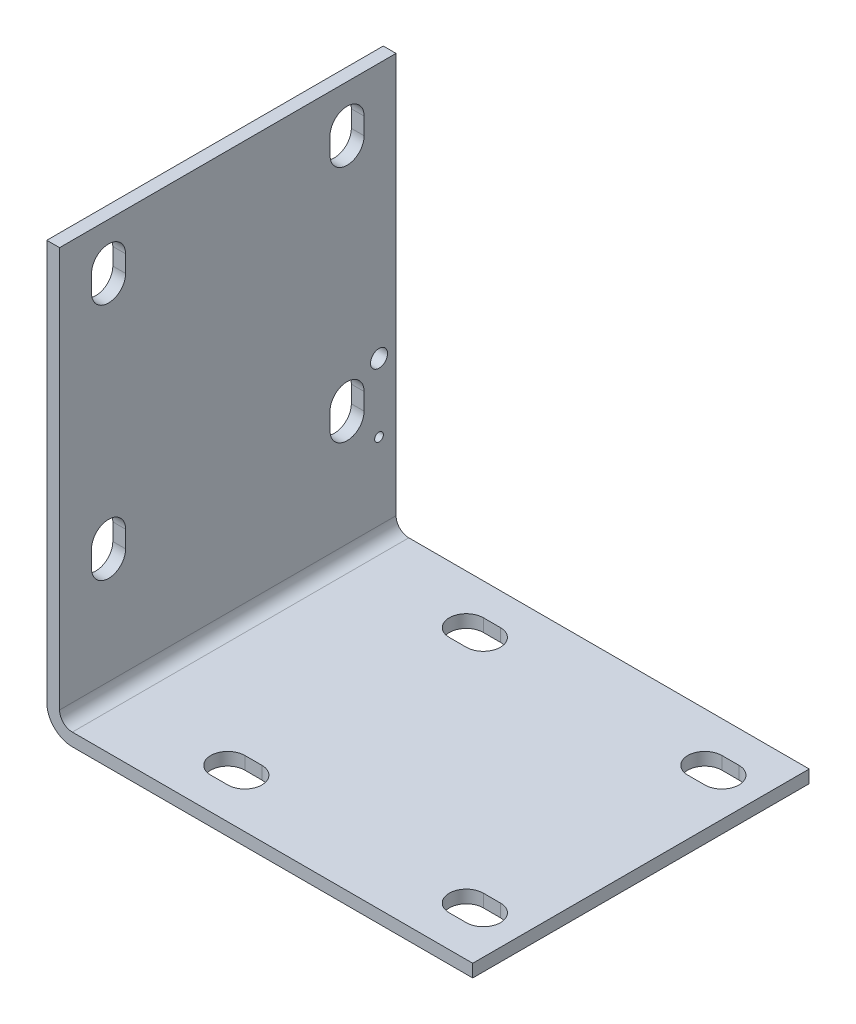
from build123d import *

# Parameters (mm, degrees)
BOSS_EXTRUDE1_DEPTH = 62.70625
CUT_EXTRUDE1_DEPTH  = 224.410663511
SKETCH3_R           = 1.625
SKETCH3_R_2         = 3.175
CUT_EXTRUDE2_DEPTH  = 224.410663511


with BuildPart() as part:
    # Sketch1 → Boss-Extrude1 (new, symmetric)
    with BuildSketch(Plane.XY):
        with BuildLine():
            Line((-9.525, 149.225), (-4.7625, 149.225))
            Line((-4.7625, 149.225), (-4.7625, 0))
            ThreePointArc((-4.7625, 0), (-3.367596045, -3.367596045), (0, -4.7625))
            Line((0, -4.7625), (149.225, -4.7625))
            Line((149.225, -4.7625), (149.225, -9.525))
            Line((149.225, -9.525), (0, -9.525))
            ThreePointArc((0, -9.525), (-6.735192091, -6.735192091), (-9.525, 0))
            Line((-9.525, 0), (-9.525, 149.225))
        make_face()
    extrude(amount=BOSS_EXTRUDE1_DEPTH, both=True)

    # Sketch2 → Cut-Extrude1 (cut, through all)
    with BuildSketch(Plane(origin=(-4.7625, 0, 0), x_dir=(0, 0, -1), z_dir=(1, 0, 0))):
        with BuildLine():
            Line((-50.8, 134.9375), (-50.8, 128.5875))
            ThreePointArc((-50.8, 128.5875), (-44.45, 122.2375), (-38.1, 128.5875))
            Line((-38.1, 128.5875), (-38.1, 134.9375))
            ThreePointArc((-38.1, 134.9375), (-44.45, 141.2875), (-50.8, 134.9375))
        make_face()
        with BuildLine():
            Line((-50.8, 46.0375), (-50.8, 39.6875))
            ThreePointArc((-50.8, 39.6875), (-44.45, 33.3375), (-38.1, 39.6875))
            Line((-38.1, 39.6875), (-38.1, 46.0375))
            ThreePointArc((-38.1, 46.0375), (-44.45, 52.3875), (-50.8, 46.0375))
        make_face()
        with BuildLine():
            Line((38.1, 39.6875), (38.1, 46.0375))
            ThreePointArc((38.1, 46.0375), (44.45, 52.3875), (50.8, 46.0375))
            Line((50.8, 46.0375), (50.8, 39.6875))
            ThreePointArc((50.8, 39.6875), (44.45, 33.3375), (38.1, 39.6875))
        make_face()
        with BuildLine():
            Line((38.1, 134.9375), (38.1, 128.5875))
            ThreePointArc((38.1, 128.5875), (44.45, 122.2375), (50.8, 128.5875))
            Line((50.8, 128.5875), (50.8, 134.9375))
            ThreePointArc((50.8, 134.9375), (44.45, 141.2875), (38.1, 134.9375))
        make_face()
    cut_extrude1 = extrude(amount=-CUT_EXTRUDE1_DEPTH, mode=Mode.SUBTRACT)

    # Mirror1: Cut-Extrude1 across plane
    add(cut_extrude1.mirror(Plane(origin=(0, 0, 0), x_dir=(0, 0, 1), z_dir=(0.7071067811865475, -0.7071067811865476, 0))), mode=Mode.SUBTRACT)

    # Sketch3 → Cut-Extrude2 (cut, through all)
    with BuildSketch(Plane(origin=(-4.7625, 0, 0), x_dir=(0, 0, -1), z_dir=(1, 0, 0))):
        with Locations((56.35625, 28.575)):
            Circle(SKETCH3_R)
        with Locations((56.35625, 53.975)):
            Circle(SKETCH3_R_2)
    extrude(amount=-CUT_EXTRUDE2_DEPTH, mode=Mode.SUBTRACT)


solid = part.part
